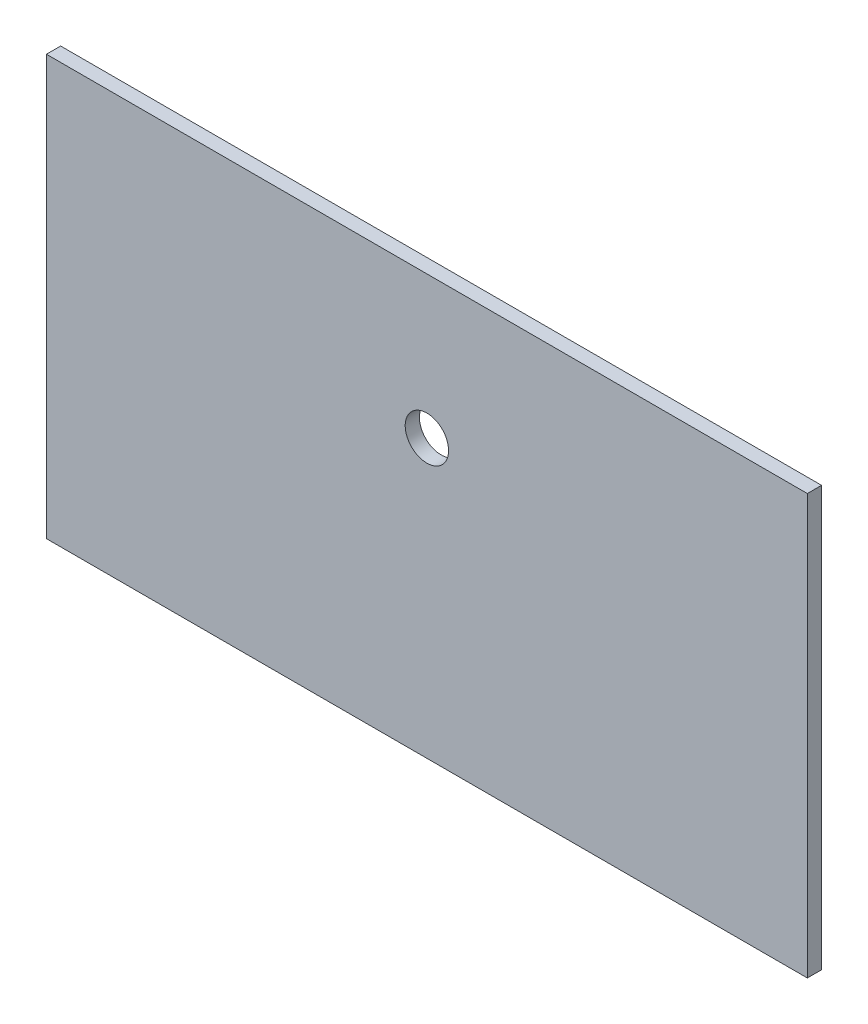
from build123d import *

# Parameters (mm, degrees)
ESBO_O1_W                = 107
ESBO_O1_H                = 59
ESBO_O1_R                = 3.05
RESSALTO_EXTRUS_O1_DEPTH = 2


with BuildPart() as part:
    # Esboço1 → Ressalto-extrusão1 (new body)
    with BuildSketch(Plane.XY):
        with Locations((53.5, 29.5)):
            Rectangle(ESBO_O1_W, ESBO_O1_H)
        with Locations((53.5, 39)):
            Circle(ESBO_O1_R, mode=Mode.SUBTRACT)
    extrude(amount=RESSALTO_EXTRUS_O1_DEPTH)


solid = part.part
